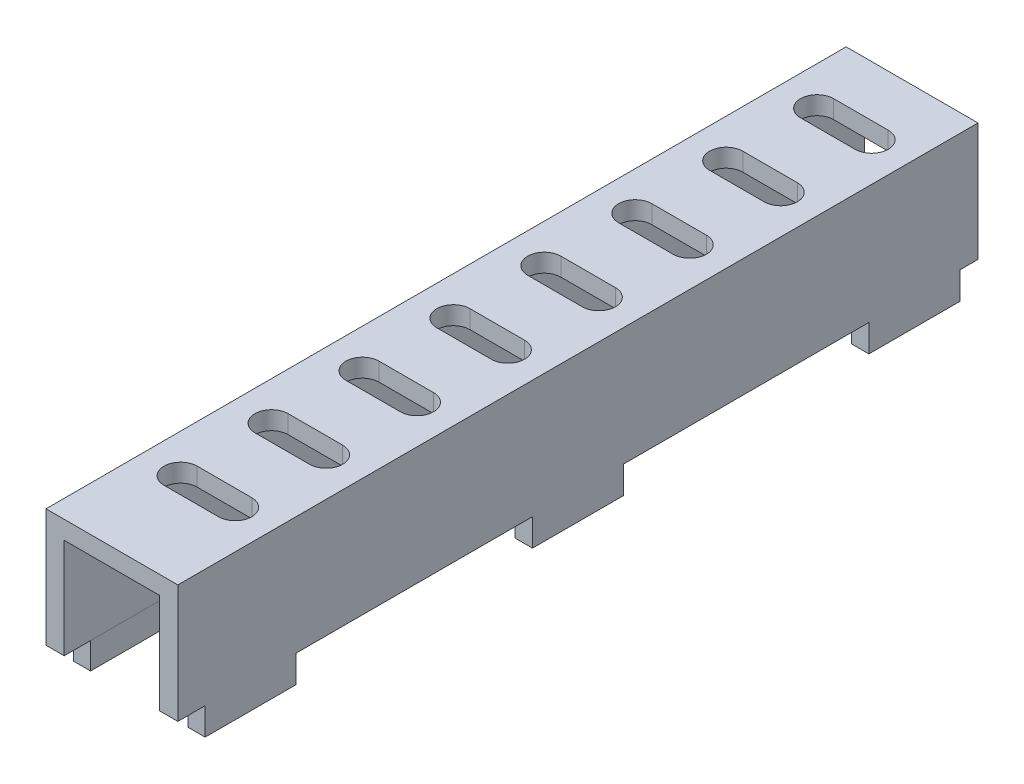
from build123d import *

# Parameters (mm, degrees)
EXTRUDE_1_DEPTH     = 88
CUT_EXTRUDE_1_DEPTH = 55
SKETCH_4_W          = 1.9
SKETCH_4_H          = 10
EXTRUDE_2_DEPTH     = 3


with BuildPart() as part:
    # 草图1 → 凸台-拉伸1 (new body)
    with BuildSketch(Plane.XY):
        Polygon((-7.25, 0), (-7.25, 13), (7.25, 13), (7.25, 0), (5.25, 0), (5.25, 11), (-5.25, 11), (-5.25, 0), align=None)
    extrude(amount=EXTRUDE_1_DEPTH)

    # 草图2 → 切除-拉伸1 (cut)
    with BuildSketch(Plane(origin=(0, 13, 0), x_dir=(1, 0, 0), z_dir=(0, 1, 0))):
        with BuildLine():
            Line((-3, -5.621760717), (3, -5.621760717))
            ThreePointArc((3, -5.621760717), (4.824580314, -7.44634103), (3, -9.270921344))
            Line((3, -9.270921344), (-3, -9.270921344))
            ThreePointArc((-3, -9.270921344), (-4.824580314, -7.44634103), (-3, -5.621760717))
        make_face()
        with BuildLine():
            Line((-3, -15.621760717), (3, -15.621760717))
            ThreePointArc((3, -15.621760717), (4.824580314, -17.44634103), (3, -19.270921344))
            Line((3, -19.270921344), (-3, -19.270921344))
            ThreePointArc((-3, -19.270921344), (-4.824580314, -17.44634103), (-3, -15.621760717))
        make_face()
        with BuildLine():
            Line((-3, -25.621760717), (3, -25.621760717))
            ThreePointArc((3, -25.621760717), (4.824580314, -27.44634103), (3, -29.270921344))
            Line((3, -29.270921344), (-3, -29.270921344))
            ThreePointArc((-3, -29.270921344), (-4.824580314, -27.44634103), (-3, -25.621760717))
        make_face()
        with BuildLine():
            Line((-3, -35.621760717), (3, -35.621760717))
            ThreePointArc((3, -35.621760717), (4.824580314, -37.44634103), (3, -39.270921344))
            Line((3, -39.270921344), (-3, -39.270921344))
            ThreePointArc((-3, -39.270921344), (-4.824580314, -37.44634103), (-3, -35.621760717))
        make_face()
        with BuildLine():
            Line((-3, -45.621760717), (3, -45.621760717))
            ThreePointArc((3, -45.621760717), (4.824580314, -47.44634103), (3, -49.270921344))
            Line((3, -49.270921344), (-3, -49.270921344))
            ThreePointArc((-3, -49.270921344), (-4.824580314, -47.44634103), (-3, -45.621760717))
        make_face()
        with BuildLine():
            Line((-3, -55.621760717), (3, -55.621760717))
            ThreePointArc((3, -55.621760717), (4.824580314, -57.44634103), (3, -59.270921344))
            Line((3, -59.270921344), (-3, -59.270921344))
            ThreePointArc((-3, -59.270921344), (-4.824580314, -57.44634103), (-3, -55.621760717))
        make_face()
        with BuildLine():
            Line((-3, -65.621760717), (3, -65.621760717))
            ThreePointArc((3, -65.621760717), (4.824580314, -67.44634103), (3, -69.270921344))
            Line((3, -69.270921344), (-3, -69.270921344))
            ThreePointArc((-3, -69.270921344), (-4.824580314, -67.44634103), (-3, -65.621760717))
        make_face()
        with BuildLine():
            Line((-3, -75.621760717), (3, -75.621760717))
            ThreePointArc((3, -75.621760717), (4.824580314, -77.44634103), (3, -79.270921344))
            Line((3, -79.270921344), (-3, -79.270921344))
            ThreePointArc((-3, -79.270921344), (-4.824580314, -77.44634103), (-3, -75.621760717))
        make_face()
    extrude(amount=-CUT_EXTRUDE_1_DEPTH, mode=Mode.SUBTRACT)

    # 草图4 → 凸台-拉伸2 (add)
    with BuildSketch(Plane.XZ):
        with Locations((6.3, 80)):
            Rectangle(SKETCH_4_W, SKETCH_4_H)
        with Locations((6.3, 44)):
            Rectangle(SKETCH_4_W, SKETCH_4_H)
        with Locations((6.3, 7)):
            Rectangle(SKETCH_4_W, SKETCH_4_H)
    extrude_2 = extrude(amount=EXTRUDE_2_DEPTH)

    # 镜向1: 凸台-拉伸2 across plane
    add(extrude_2.mirror(Plane(origin=(0, 0, 0), x_dir=(0, 0, 1), z_dir=(1, 0, 0))))


solid = part.part
